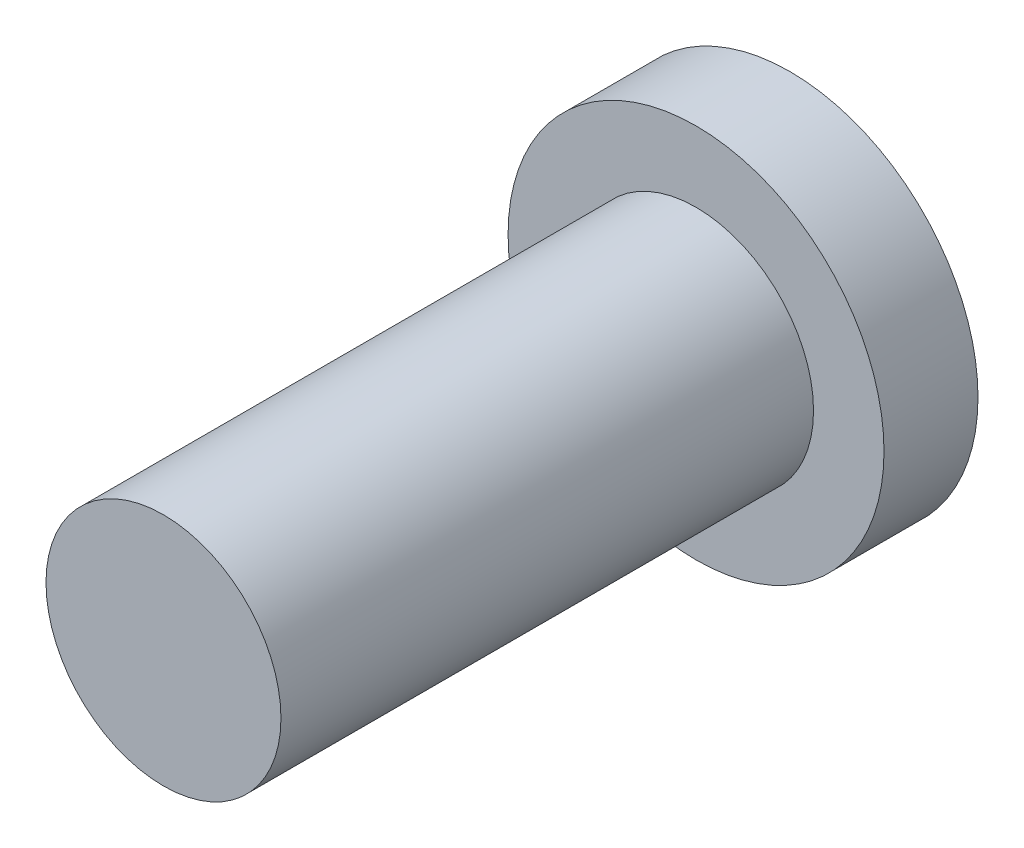
from build123d import *

# Parameters (mm, degrees)
SKETCH1_R           = 6
SKETCH1_R_2         = 3.75
BOSS_EXTRUDE1_DEPTH = 3
SKETCH1_2_R         = 3.75
BOSS_EXTRUDE2_DEPTH = 20


with BuildPart() as part:
    # Sketch1 → Boss-Extrude1 (new body)
    with BuildSketch(Plane.XY):
        Circle(SKETCH1_R)
        Circle(SKETCH1_R_2, mode=Mode.SUBTRACT)
    extrude(amount=BOSS_EXTRUDE1_DEPTH)

    # Sketch1<2> → Boss-Extrude2 (add)
    with BuildSketch(Plane.XY):
        Circle(SKETCH1_2_R)
    extrude(amount=BOSS_EXTRUDE2_DEPTH)


solid = part.part
